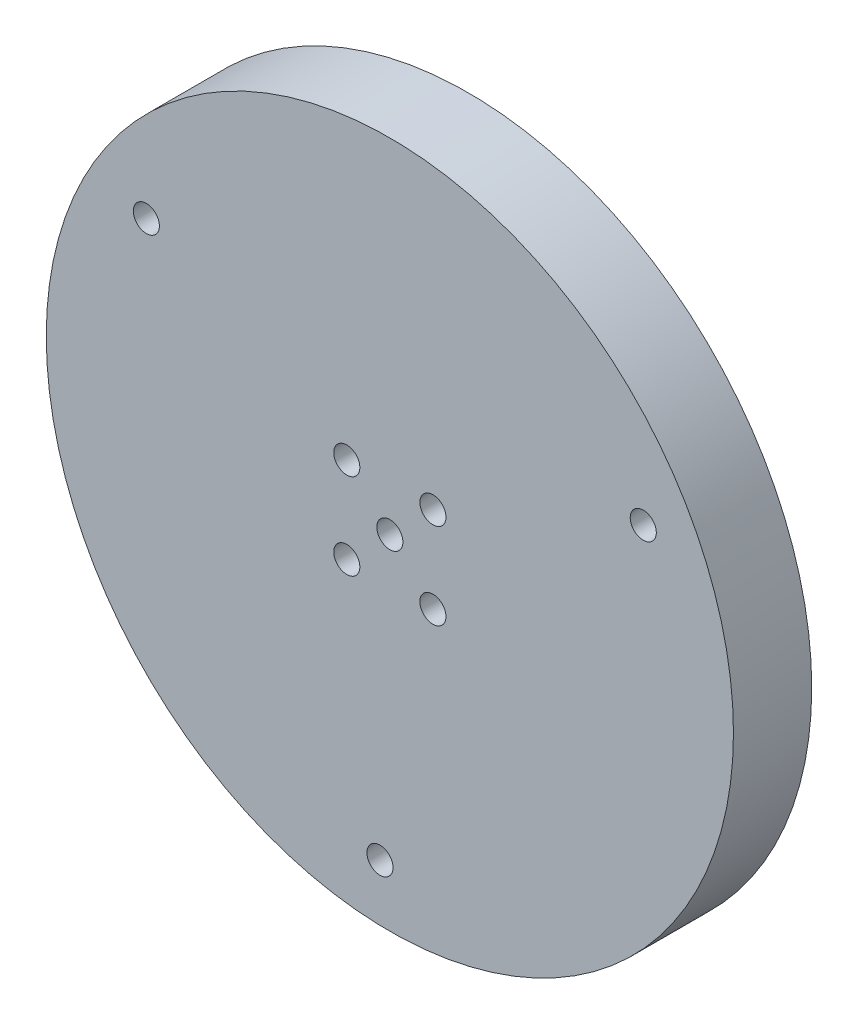
from build123d import *

# Parameters (mm, degrees)
SKETCH_1_R          = 39.5
EXTRUDE_1_DEPTH     = 9
SKETCH_2_R          = 20
CUT_EXTRUDE_1_DEPTH = 5
SKETCH_3_R          = 1.5
CUT_EXTRUDE_2_DEPTH = 57.581799194
SKETCH_4_R          = 1.5
CUT_EXTRUDE_3_DEPTH = 57.084757288


with BuildPart() as part:
    # 草图1 → 凸台-拉伸1 (new body)
    with BuildSketch(Plane.XY):
        Circle(SKETCH_1_R)
    extrude(amount=EXTRUDE_1_DEPTH)

    # 草图2 → 切除-拉伸1 (cut)
    with BuildSketch(Plane(origin=(0, 0, 0), x_dir=(-1, 0, 0), z_dir=(0, 0, -1))):
        Circle(SKETCH_2_R)
    extrude(amount=-CUT_EXTRUDE_1_DEPTH, mode=Mode.SUBTRACT)

    # 草图3 → 切除-拉伸2 (cut, through all)
    with BuildSketch(Plane(origin=(0, 0, 0), x_dir=(-1, 0, 0), z_dir=(0, 0, -1))):
        with Locations((1.136716128, -32.98041656)):
            Circle(SKETCH_3_R)
        with Locations((-29.130236632, 15.505783236)):
            Circle(SKETCH_3_R)
        with Locations((27.993520504, 17.474633324)):
            Circle(SKETCH_3_R)
    extrude(amount=-CUT_EXTRUDE_2_DEPTH, mode=Mode.SUBTRACT)

    # 草图4 → 切除-拉伸3 (cut, through all)
    with BuildSketch(Plane(origin=(0, 0, 5), x_dir=(-1, 0, 0), z_dir=(0, 0, -1))):
        Circle(SKETCH_4_R)
        with Locations((-4.949747468, 4.949747468)):
            Circle(SKETCH_4_R)
        with Locations((4.949747468, 4.949747468)):
            Circle(SKETCH_4_R)
        with Locations((4.949747468, -4.949747468)):
            Circle(SKETCH_4_R)
        with Locations((-4.949747468, -4.949747468)):
            Circle(SKETCH_4_R)
    extrude(amount=-CUT_EXTRUDE_3_DEPTH, mode=Mode.SUBTRACT)


solid = part.part
